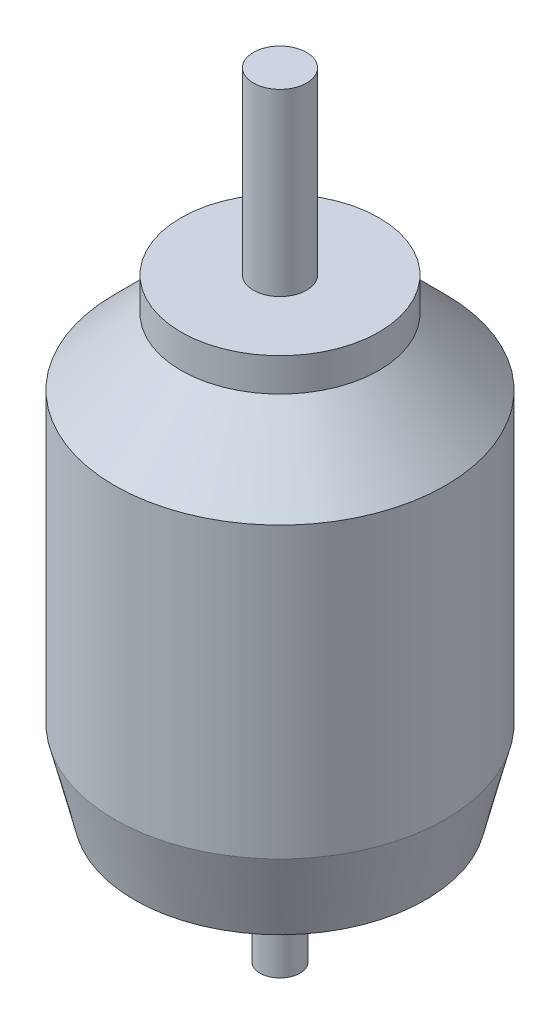
from build123d import *

# Parameters (mm, degrees)
SKETCH2_R                       = 3
BOSS_EXTRUDE3_DEPTH             = 18.5
SKETCH3_R                       = 6
BOSS_EXTRUDE5_DEPTH             = 0.5
SKETCH5_R                       = 24.9
BOSS_EXTRUDE6_DEPTH             = 65.5
SKETCH6_R                       = 4
BOSS_EXTRUDE7_DEPTH             = 32
CHAMFER1_SIZE                   = 3
CHAMFER1_SIZE2                  = 12
CHAMFER2_SIZE                   = 10
SKETCH7_R                       = 14.9
BOSS_EXTRUDE8_DEPTH             = 5
M4X0_7_TAPPED_HOLE1_D           = 3.3
M4X0_7_TAPPED_HOLE1_DEPTH       = 10.508579979
M4X0_7_TAPPED_HOLE1_CSINK_D     = 4.05
M4X0_7_TAPPED_HOLE1_CSINK_ANGLE = 90
M4X0_7_TAPPED_HOLE1_TIP         = 0.991420021


with BuildPart() as part:
    # Sketch2 → Boss-Extrude3 (new body)
    with BuildSketch(Plane(origin=(0, 0, 0), x_dir=(1, 0, 0), z_dir=(0, 1, 0))):
        with Locations(Location((0, 0, 0), (0, 0, 270))):
            Circle(SKETCH2_R)
    extrude(amount=BOSS_EXTRUDE3_DEPTH)

    # Sketch3 → Boss-Extrude5 (add)
    with BuildSketch(Plane(origin=(0, 18.5, 0), x_dir=(1, 0, 0), z_dir=(0, 1, 0))):
        with Locations(Location((0, 0, 0), (0, 0, 270))):
            Circle(SKETCH3_R)
    extrude(amount=BOSS_EXTRUDE5_DEPTH)

    # Sketch5 → Boss-Extrude6 (add)
    with BuildSketch(Plane(origin=(0, 19, 0), x_dir=(1, 0, 0), z_dir=(0, 1, 0))):
        with Locations(Location((0, 0, 0), (0, 0, 270))):
            Circle(SKETCH5_R)
    extrude(amount=BOSS_EXTRUDE6_DEPTH)

    # Sketch6 → Boss-Extrude7 (add)
    with BuildSketch(Plane(origin=(0, 84.5, 0), x_dir=(1, 0, 0), z_dir=(0, 1, 0))):
        with Locations(Location((0, 0, 0), (0, 0, 270))):
            Circle(SKETCH6_R)
    extrude(amount=BOSS_EXTRUDE7_DEPTH)

    # Chamfer1
    chamfer1_edges = [part.edges().sort_by_distance(p)[0] for p in [
        (0, 19, -24.9),
    ]]
    chamfer1_side = [part.faces().sort_by_distance(p)[0] for p in [
        (0, 19, -24.195721646),
    ]]
    chamfer(chamfer1_edges, length=CHAMFER1_SIZE, length2=CHAMFER1_SIZE2, reference=chamfer1_side[0])

    # Chamfer2
    chamfer2_edges = [part.edges().sort_by_distance(p)[0] for p in [
        (0, 84.5, -24.9),
    ]]
    chamfer(chamfer2_edges, length=CHAMFER2_SIZE)

    # Sketch7 → Boss-Extrude8 (add)
    with BuildSketch(Plane(origin=(0, 84.5, 0), x_dir=(1, 0, 0), z_dir=(0, 1, 0))):
        with Locations(Location((0, 0, 0), (0, 0, 270))):
            Circle(SKETCH7_R)
    extrude(amount=BOSS_EXTRUDE8_DEPTH)

    # M4x0.7 Tapped Hole1
    with Locations(Plane(origin=(0, 19, 0), x_dir=(-1, 0, 0), z_dir=(0, -1, 0))):
        with Locations((-10.606601718, 10.606601718), (10.606601718, -10.606601718), (10.606601718, 10.606601718), (-10.606601718, -10.606601718)):
            CounterSinkHole(M4X0_7_TAPPED_HOLE1_D / 2, M4X0_7_TAPPED_HOLE1_CSINK_D / 2, depth=M4X0_7_TAPPED_HOLE1_DEPTH, counter_sink_angle=M4X0_7_TAPPED_HOLE1_CSINK_ANGLE)
            with Locations((0, 0, -(M4X0_7_TAPPED_HOLE1_DEPTH + M4X0_7_TAPPED_HOLE1_TIP / 2))):  # 118° drill point
                Cone(0, M4X0_7_TAPPED_HOLE1_D / 2, M4X0_7_TAPPED_HOLE1_TIP, mode=Mode.SUBTRACT)


solid = part.part
